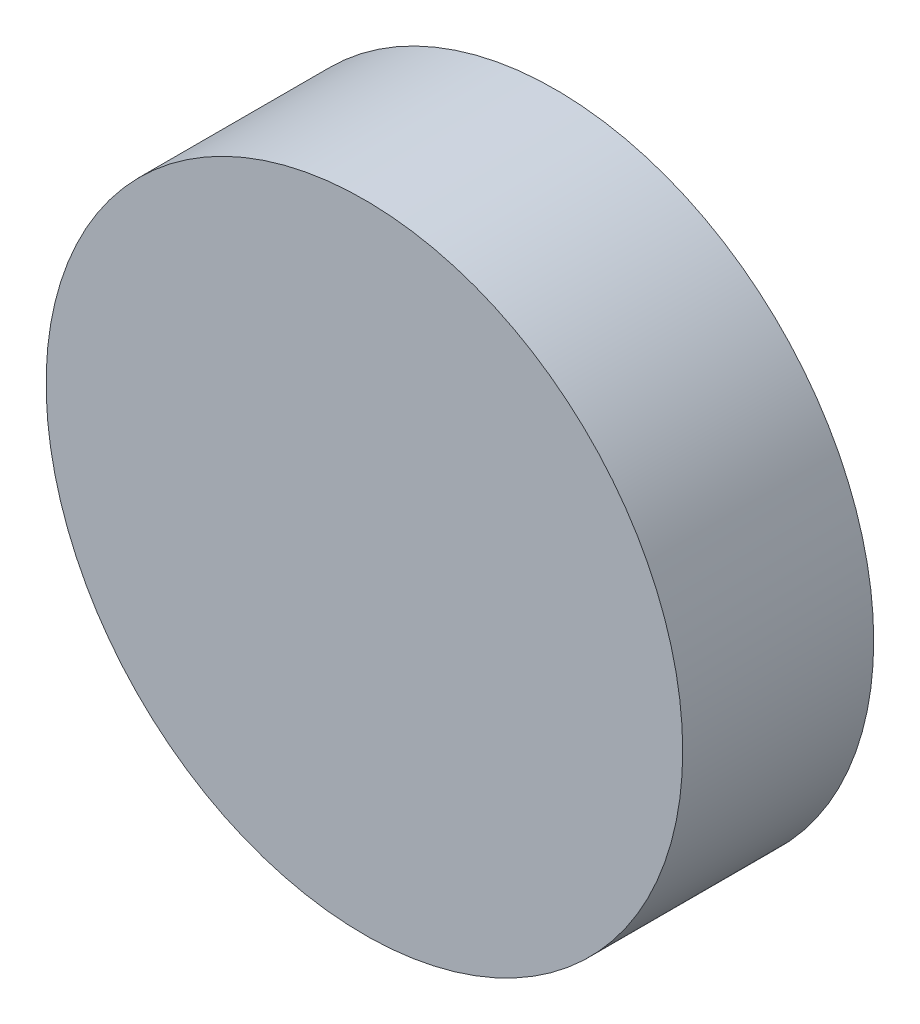
from build123d import *

# Parameters (mm, degrees)
SKETCH1_R           = 5
BOSS_EXTRUDE1_DEPTH = 3


with BuildPart() as part:
    # Sketch1 → Boss-Extrude1 (new body)
    with BuildSketch(Plane.XY):
        Circle(SKETCH1_R)
    extrude(amount=BOSS_EXTRUDE1_DEPTH)


solid = part.part
